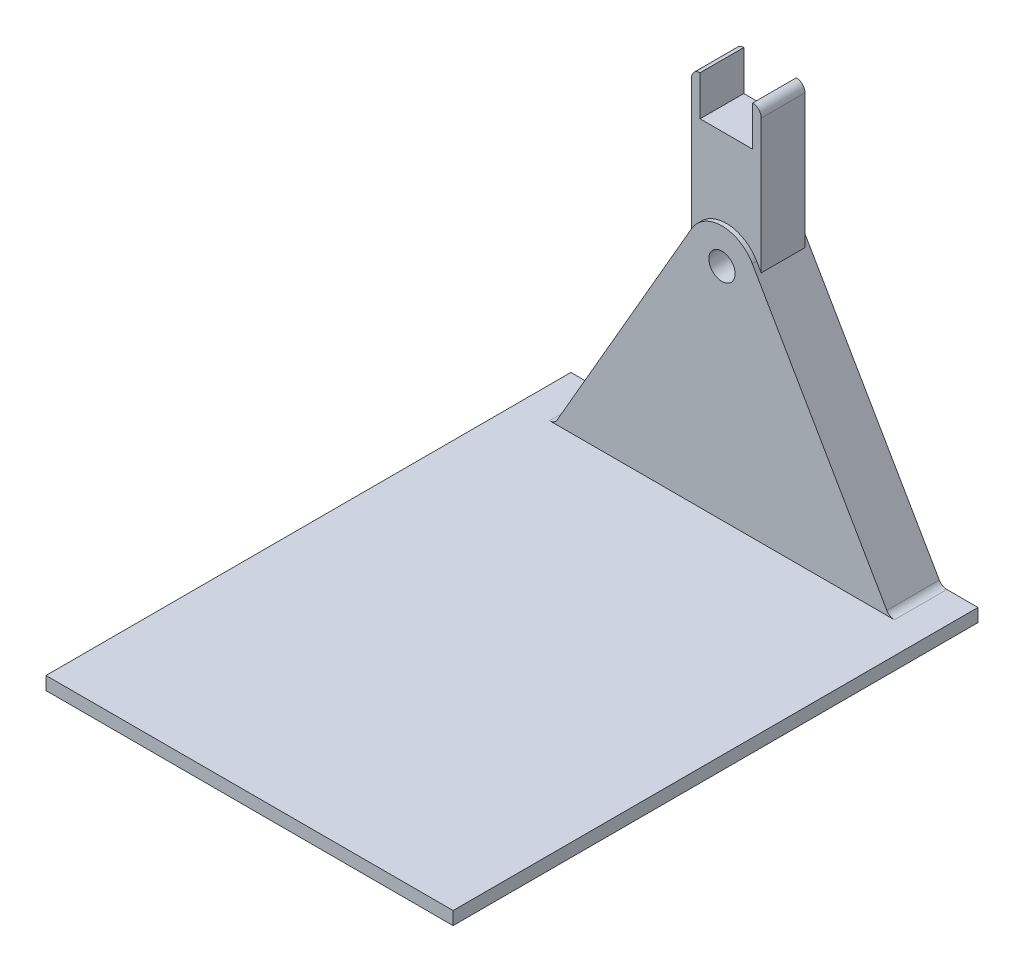
from build123d import *

# Parameters (mm, degrees)
EXTRUDE_1_DEPTH     = 3
EXTRUDE_2_DEPTH     = 2.5
SKETCH_3_W          = 46.535898384
SKETCH_3_H          = 60
EXTRUDE_3_DEPTH     = 1.5
FILLET_1_R          = 1
SKETCH_4_R          = 1.5
CUT_EXTRUDE_1_DEPTH = 70.387823433


with BuildPart() as part:
    # 草圖1 → 填料-伸長1 (new, symmetric)
    with BuildSketch(Plane.XY):
        with BuildLine():
            ThreePointArc((3.464101615, 10.536922378), (2, 12.001023993), (0, 12.536922378))
            Line((0, 12.536922378), (0, -18.104093774))
            Line((0, -18.104093774), (18.267949192, -18.104093774))
            ThreePointArc((18.267949192, -18.104093774), (19.133974596, -17.604093774), (19.133974596, -16.604093774))
            Line((19.133974596, -16.604093774), (3.464101615, 10.536922378))
        make_face()
        with BuildLine():
            ThreePointArc((0, 12.536922378), (-2, 12.001023993), (-3.464101615, 10.536922378))
            Line((-3.464101615, 10.536922378), (-19.133974596, -16.604093774))
            ThreePointArc((-19.133974596, -16.604093774), (-19.133974596, -17.604093774), (-18.267949192, -18.104093774))
            Line((-18.267949192, -18.104093774), (0, -18.104093774))
            Line((0, -18.104093774), (0, 12.536922378))
        make_face()
    extrude(amount=EXTRUDE_1_DEPTH, both=True)

    # 草圖2 → 填料-伸長2 (add, symmetric)
    with BuildSketch(Plane.XY):
        with BuildLine():
            Line((-3.98839196, 24.947564001), (-3.98839196, 8.841437682))
            Line((-3.98839196, 8.841437682), (3.98839196, 8.841437682))
            Line((3.98839196, 8.841437682), (3.98839196, 24.947564001))
            ThreePointArc((3.98839196, 24.947564001), (3.699590962, 25.65055474), (3, 25.947496625))
            Line((3, 25.947496625), (3, 21.386539183))
            Line((3, 21.386539183), (0, 21.386539183))
            Line((0, 21.386539183), (-3, 21.386539183))
            Line((-3, 21.386539183), (-3, 25.947496625))
            ThreePointArc((-3, 25.947496625), (-3.699590962, 25.65055474), (-3.98839196, 24.947564001))
        make_face()
    extrude(amount=EXTRUDE_2_DEPTH, both=True)

    # 草圖3 → 填料-伸長3 (add)
    with BuildSketch(Plane.XZ.offset(18.104093774)):
        with Locations((0, 27)):
            Rectangle(SKETCH_3_W, SKETCH_3_H)
    extrude(amount=-EXTRUDE_3_DEPTH)

    # 圓角1
    fillet_1_edges = [part.edges().sort_by_distance(p)[0] for p in [
        (19.133974596, -16.604093774, 0),
        (-19.133974596, -16.604093774, 0),
    ]]
    fillet(fillet_1_edges, radius=FILLET_1_R)

    # 草圖4 → 除料-伸長1 (cut, through all)
    with BuildSketch(Plane(origin=(0, 0, -3), x_dir=(-1, 0, 0), z_dir=(0, 0, -1))):
        with Locations((0, 8.536922378)):
            Circle(SKETCH_4_R)
    extrude(amount=-CUT_EXTRUDE_1_DEPTH, mode=Mode.SUBTRACT)


solid = part.part
